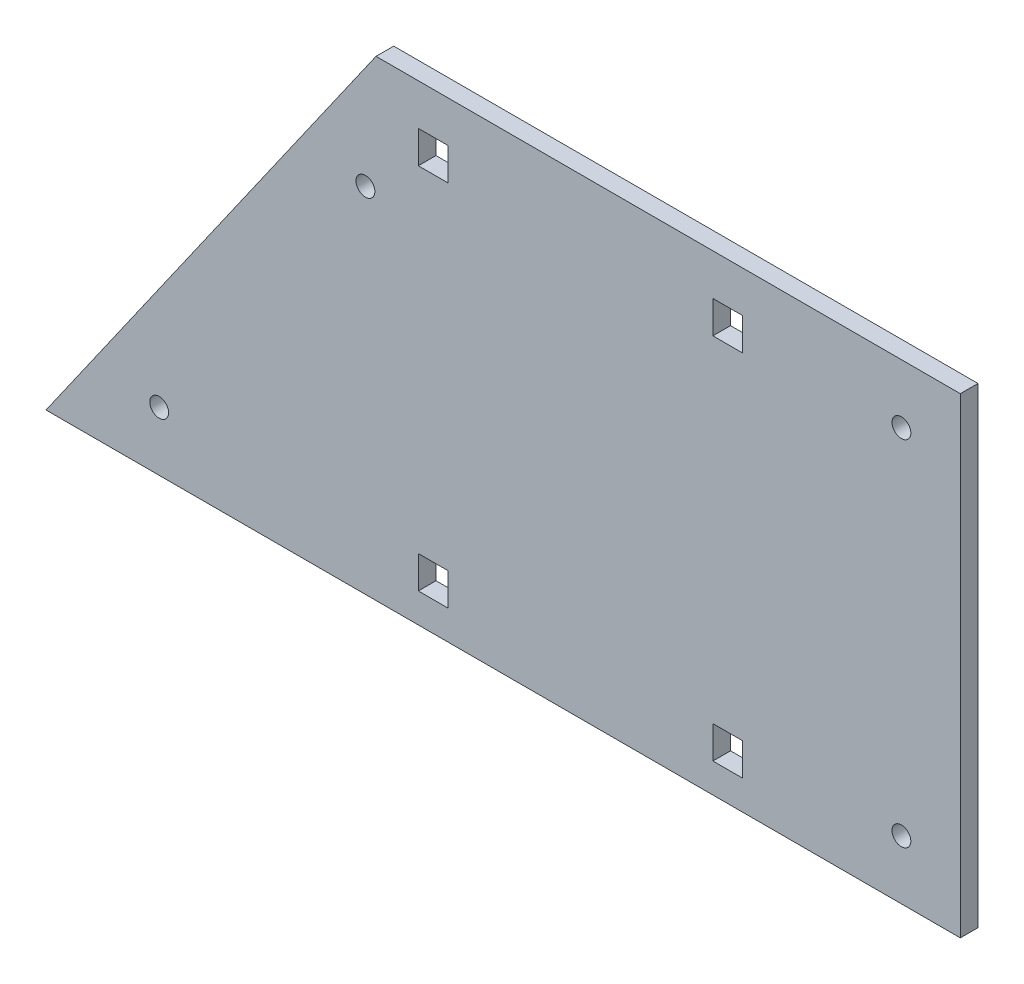
from build123d import *

# Parameters (mm, degrees)
SKETCH_1_R             = 1.6
EXTRUDE_2_DEPTH        = 3
SKETCH_2_W             = 5
SKETCH_2_H             = 5.5
CUT_EXTRUDE_1_DEPTH    = 5
PATTERN_LINEAR_1_COUNT = 2
PATTERN_LINEAR_1_PITCH = 62.5


with BuildPart() as part:
    # 草图1 → 凸台-拉伸2 (new body)
    with BuildSketch(Plane.XY):
        Polygon((137.75, -25.25), (38.57, -25.25), (-17.446603057, -105.25), (137.75, -105.25), align=None)
        with Locations((36.773595123, -45.25)):
            Circle(SKETCH_1_R, mode=Mode.SUBTRACT)
        with Locations((1.763218213, -95.25)):
            Circle(SKETCH_1_R, mode=Mode.SUBTRACT)
        with Locations((127.75, -35.25)):
            Circle(SKETCH_1_R, mode=Mode.SUBTRACT)
        with Locations((127.75, -95.25)):
            Circle(SKETCH_1_R, mode=Mode.SUBTRACT)
    extrude(amount=EXTRUDE_2_DEPTH)

    # 草图2 → 切除-拉伸1 (cut)
    with BuildSketch(Plane.XY.offset(3)):
        with Locations((98.25, -97.5)):
            Rectangle(SKETCH_2_W, SKETCH_2_H)
        with Locations((48.25, -97.5)):
            Rectangle(SKETCH_2_W, SKETCH_2_H)
    cut_extrude_1 = extrude(amount=-CUT_EXTRUDE_1_DEPTH, mode=Mode.SUBTRACT)

    # 阵列(线性)1: 切除-拉伸1 ×2
    with Locations(*[(0, i * PATTERN_LINEAR_1_PITCH, 0) for i in range(1, PATTERN_LINEAR_1_COUNT)]):
        add(cut_extrude_1, mode=Mode.SUBTRACT)


solid = part.part
